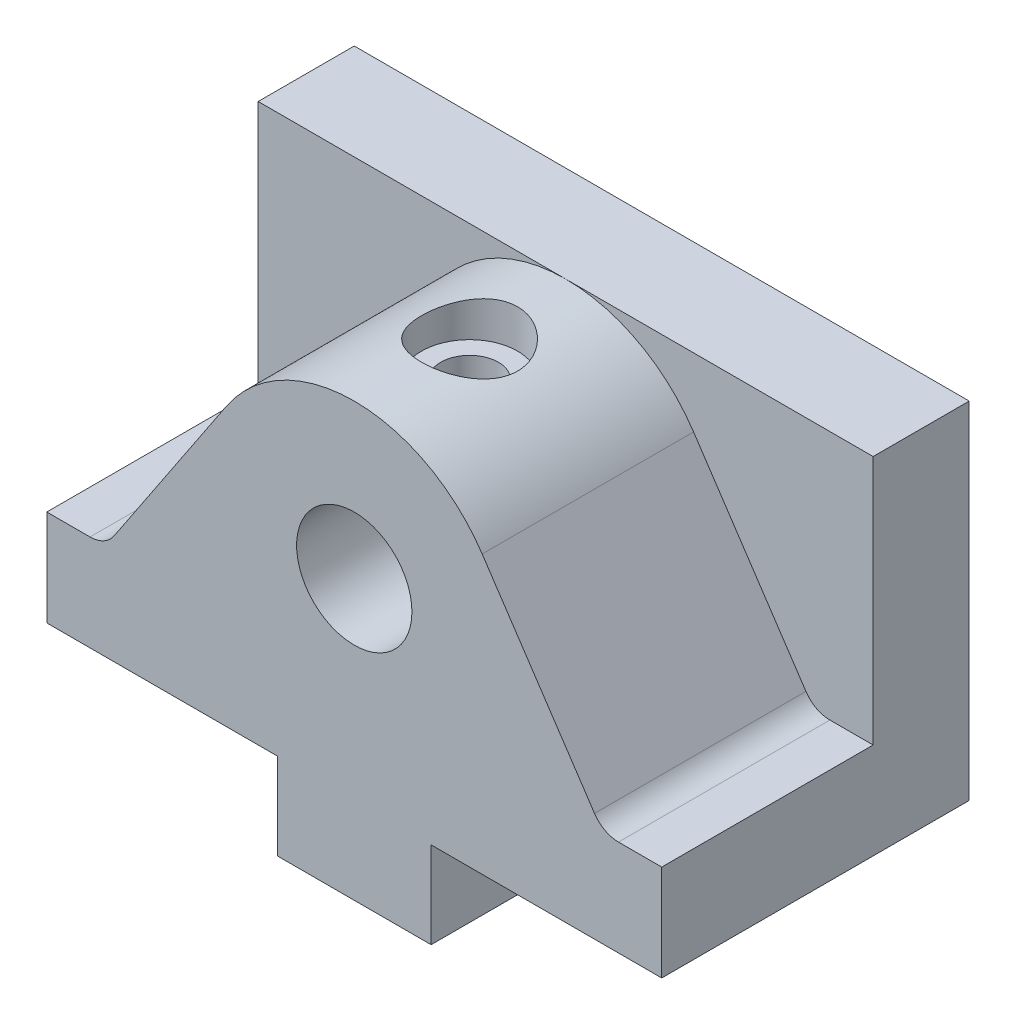
from build123d import *

# Parameters (mm, degrees)
SKETCH2_R                       = 6
SKETCH2_W                       = 16
SKETCH2_H                       = 9
BOSS_EXTRUDE1_DEPTH             = 22
BOSS_EXTRUDE2_START             = -10
SKETCH2_9_R                     = 6
BOSS_EXTRUDE2_DEPTH             = 10
CUT_EXTRUDE1_START              = -2
SKETCH3_R                       = 6
CUT_EXTRUDE1_DEPTH              = 2
SKETCH5_W                       = 16
SKETCH5_H                       = 9
BOSS_EXTRUDE3_DEPTH             = 10
M6X1_0_TAPPED_HOLE1_D           = 6
M6X1_0_TAPPED_HOLE1_DEPTH       = 16
M6X1_0_TAPPED_HOLE1_CSINK_D     = 6.05
M6X1_0_TAPPED_HOLE1_CSINK_ANGLE = 90
M6X1_0_TAPPED_HOLE1_TIP         = 1.732050808
HOLE1_D                         = 6
HOLE1_DEPTH                     = 15
HOLE1_CBORE_D                   = 10
HOLE1_CBORE_DEPTH               = 4


with BuildPart() as part:
    # Sketch2 → Boss-Extrude1 (new body)
    # profile 1 of 2: a face of its own
    with BuildSketch(Plane.XY):
        with BuildLine():
            Line((-32, 26), (-32, 16))
            Line((-32, 16), (-8, 16))
            Line((-8, 16), (8, 16))
            Line((8, 16), (32, 16))
            Line((32, 16), (32, 26))
            Line((32, 26), (27.5, 26))
            ThreePointArc((27.5, 26), (26.084330962, 26.355027189), (25.003729255, 27.336079218))
            Line((25.003729255, 27.336079218), (13.313443971, 44.874244172))
            ThreePointArc((13.313443971, 44.874244172), (7.550234872, 50.106521661), (0, 52))
            ThreePointArc((0, 52), (-7.550234872, 50.106521661), (-13.313443971, 44.874244172))
            Line((-13.313443971, 44.874244172), (-25.003729255, 27.336079218))
            ThreePointArc((-25.003729255, 27.336079218), (-26.084330962, 26.355027189), (-27.5, 26))
            Line((-27.5, 26), (-32, 26))
        make_face()
        with Locations((0, 36)):
            Circle(SKETCH2_R, mode=Mode.SUBTRACT)
    # profile 2 of 2: a face of its own
    with BuildSketch(Plane.XY):
        with Locations((0, 11.5)):
            Rectangle(SKETCH2_W, SKETCH2_H)
    extrude(amount=BOSS_EXTRUDE1_DEPTH)

    # Sketch2<9> → Boss-Extrude2 (add)
    # profile 1 of 4: a face of its own
    with BuildSketch(Plane.XY.offset(BOSS_EXTRUDE2_START)):
        with BuildLine():
            Line((32, 52), (0, 52))
            ThreePointArc((0, 52), (7.550234872, 50.106521661), (13.313443971, 44.874244172))
            Line((13.313443971, 44.874244172), (25.003729255, 27.336079218))
            ThreePointArc((25.003729255, 27.336079218), (26.084330962, 26.355027189), (27.5, 26))
            Line((27.5, 26), (32, 26))
            Line((32, 26), (32, 52))
        make_face()
    # profile 2 of 4: a face of its own
    with BuildSketch(Plane.XY.offset(BOSS_EXTRUDE2_START)):
        with BuildLine():
            Line((-32, 26), (-32, 16))
            Line((-32, 16), (-8, 16))
            Line((-8, 16), (8, 16))
            Line((8, 16), (32, 16))
            Line((32, 16), (32, 26))
            Line((32, 26), (27.5, 26))
            ThreePointArc((27.5, 26), (26.084330962, 26.355027189), (25.003729255, 27.336079218))
            Line((25.003729255, 27.336079218), (13.313443971, 44.874244172))
            ThreePointArc((13.313443971, 44.874244172), (7.550234872, 50.106521661), (0, 52))
            ThreePointArc((0, 52), (-7.550234872, 50.106521661), (-13.313443971, 44.874244172))
            Line((-13.313443971, 44.874244172), (-25.003729255, 27.336079218))
            ThreePointArc((-25.003729255, 27.336079218), (-26.084330962, 26.355027189), (-27.5, 26))
            Line((-27.5, 26), (-32, 26))
        make_face()
        with Locations((0, 36)):
            Circle(SKETCH2_9_R, mode=Mode.SUBTRACT)
    # profile 3 of 4: a face of its own
    with BuildSketch(Plane.XY.offset(BOSS_EXTRUDE2_START)):
        with BuildLine():
            Line((-32, 52), (-32, 26))
            Line((-32, 26), (-27.5, 26))
            ThreePointArc((-27.5, 26), (-26.084330962, 26.355027189), (-25.003729255, 27.336079218))
            Line((-25.003729255, 27.336079218), (-13.313443971, 44.874244172))
            ThreePointArc((-13.313443971, 44.874244172), (-7.550234872, 50.106521661), (0, 52))
            Line((0, 52), (-32, 52))
        make_face()
    # profile 4 of 4: a face of its own
    with BuildSketch(Plane.XY.offset(BOSS_EXTRUDE2_START)):
        with Locations((0, 36)):
            Circle(SKETCH2_9_R)
    extrude(amount=BOSS_EXTRUDE2_DEPTH)

    # Sketch3 → Cut-Extrude1 (cut)
    with BuildSketch(Plane.XY.offset(CUT_EXTRUDE1_START)):
        with Locations((0, 36)):
            Circle(SKETCH3_R)
    extrude(amount=CUT_EXTRUDE1_DEPTH, mode=Mode.SUBTRACT)

    # Sketch5 → Boss-Extrude3 (add)
    with BuildSketch(Plane(origin=(0, 0, 0), x_dir=(-1, 0, 0), z_dir=(0, 0, -1))):
        with Locations((0, 11.5)):
            Rectangle(SKETCH5_W, SKETCH5_H)
    extrude(amount=BOSS_EXTRUDE3_DEPTH)

    # M6x1.0 Tapped Hole1
    with Locations(Plane(origin=(0, 7, 14), x_dir=(-1, 0, 0), z_dir=(0, -1, 0))):
        with Locations((0, 0), (0, 16)):
            CounterSinkHole(M6X1_0_TAPPED_HOLE1_D / 2, M6X1_0_TAPPED_HOLE1_CSINK_D / 2, depth=M6X1_0_TAPPED_HOLE1_DEPTH, counter_sink_angle=M6X1_0_TAPPED_HOLE1_CSINK_ANGLE)
            with Locations((0, 0, -(M6X1_0_TAPPED_HOLE1_DEPTH + M6X1_0_TAPPED_HOLE1_TIP / 2))):  # 120° drill point
                Cone(0, M6X1_0_TAPPED_HOLE1_D / 2, M6X1_0_TAPPED_HOLE1_TIP, mode=Mode.SUBTRACT)

    # Hole1
    with Locations(Plane(origin=(0, 52, 10), x_dir=(1, 0, 0), z_dir=(0, 1, 0))):
        with Locations((0, 0)):
            CounterBoreHole(HOLE1_D / 2, HOLE1_CBORE_D / 2, HOLE1_CBORE_DEPTH, depth=HOLE1_DEPTH)


solid = part.part
